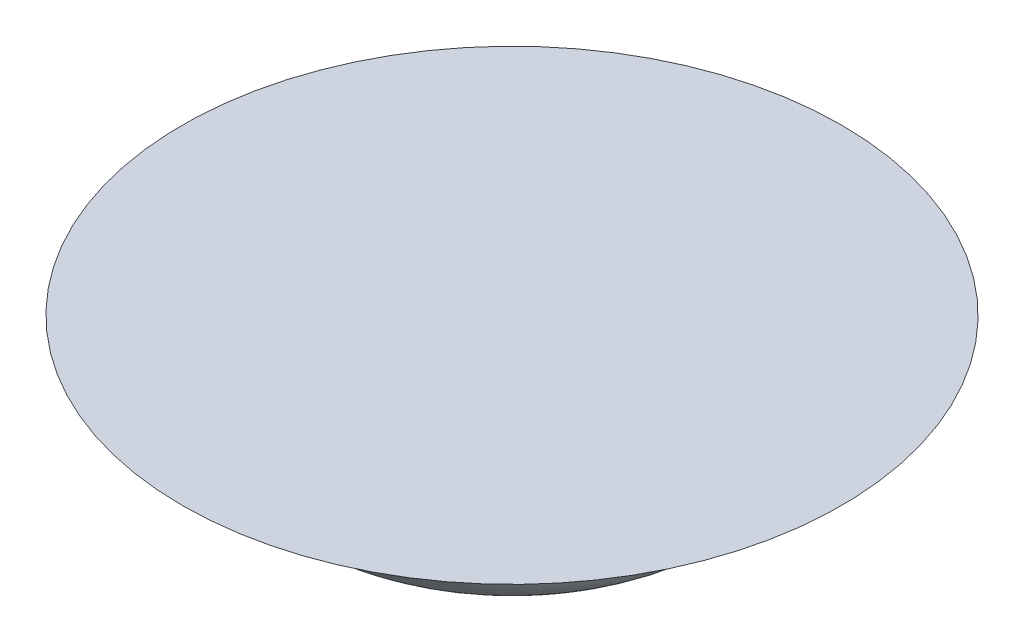
from build123d import *

# Parameters (mm, degrees)
SKETCH1_W           = 203.69051182
SKETCH1_H           = 2
BASE_EXTRUDE_DEPTH  = 60
SKETCH3_R           = 10
BOSS_EXTRUDE1_DEPTH = 5
FILLET_2_R          = 3
FILLET2_R           = 5
SKETCH4_W           = 120
SKETCH4_H           = 2
CUT_EXTRUDE1_DEPTH  = 213.402506245


with BuildPart() as part:
    # Sketch1 → Base-Extrude (new, symmetric)
    with BuildSketch(Plane.XY):
        with Locations((0, 1)):
            Rectangle(SKETCH1_W, SKETCH1_H)
    extrude(amount=BASE_EXTRUDE_DEPTH, both=True)

    # Sketch3 → Boss-Extrude1 (add)
    with BuildSketch(Plane.XZ):
        with Locations(Location((0, 0, 0), (0, 0, 90))):
            Circle(SKETCH3_R)
    extrude(amount=BOSS_EXTRUDE1_DEPTH)

    # Fillet 2
    fillet_2_edges = [part.edges().sort_by_distance(p)[0] for p in [
        (0, -5, -10),
    ]]
    fillet(fillet_2_edges, radius=FILLET_2_R)

    # Fillet2
    fillet2_edges = [part.edges().sort_by_distance(p)[0] for p in [
        (0, 0, -10),
    ]]
    fillet(fillet2_edges, radius=FILLET2_R)

    # Sketch4 → Cut-Extrude1 (cut, through all)
    with BuildSketch(Plane(origin=(101.84525591, 0, 0), x_dir=(0, 0, -1), z_dir=(1, 0, 0))):
        with Locations((0, 1)):
            Rectangle(SKETCH4_W, SKETCH4_H)
    extrude(amount=-CUT_EXTRUDE1_DEPTH, mode=Mode.SUBTRACT)


solid = part.part
